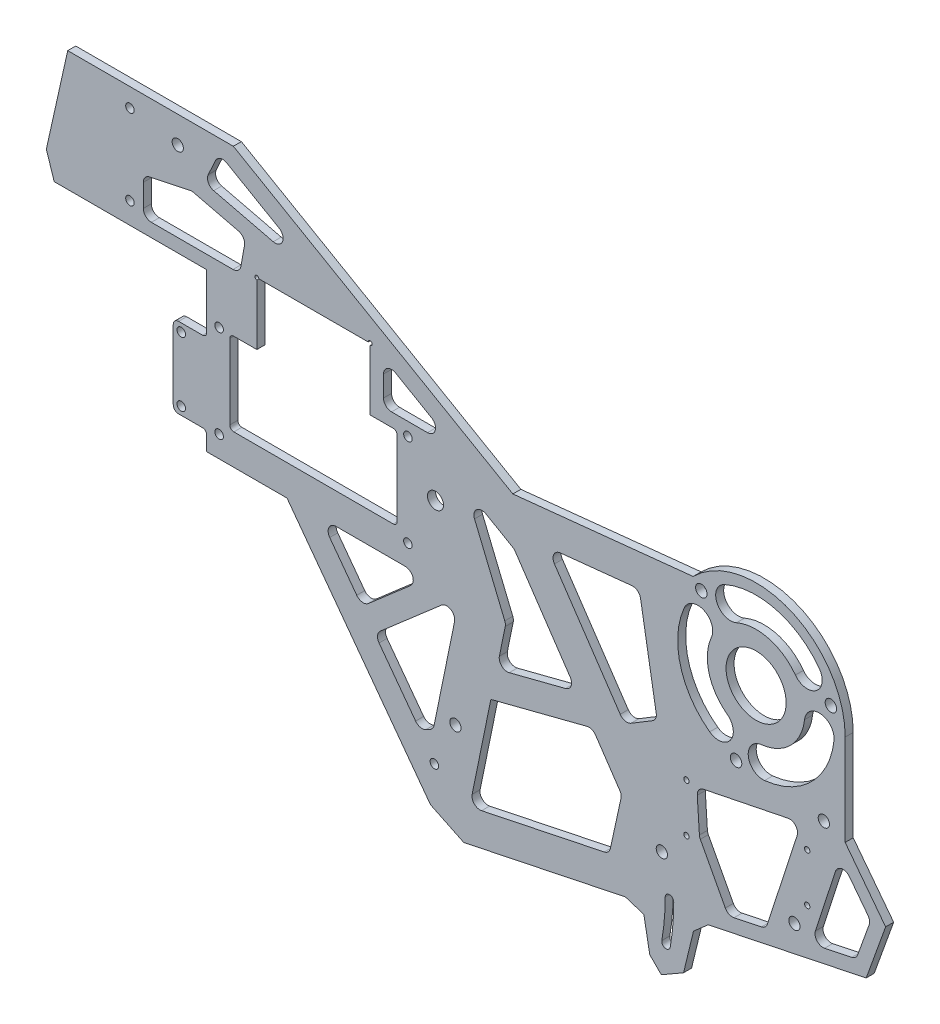
from build123d import *

# Parameters (mm, degrees)
SKETCH1_W           = 184.414327478
SKETCH1_H           = 83.61431582
BOSS_EXTRUDE1_DEPTH = 3
SKETCH2_R           = 3
CUT_EXTRUDE1_DEPTH  = 70
SKETCH3_R           = 11.25
CUT_EXTRUDE2_DEPTH  = 3
SKETCH4_R           = 1.6
BOSS_EXTRUDE2_DEPTH = 3
CUT_EXTRUDE3_DEPTH  = 10
SKETCH6_R           = 1.6
CUT_EXTRUDE4_DEPTH  = 3
FILLET1_R           = 1.5
SKETCH8_R           = 1.6
CUT_EXTRUDE6_DEPTH  = 12
SKETCH9_R           = 2.15
CUT_EXTRUDE7_DEPTH  = 12
BOSS_EXTRUDE3_DEPTH = 3
SKETCH12_R          = 1.6
CUT_EXTRUDE8_DEPTH  = 10
SKETCH13_R          = 1
CUT_EXTRUDE9_DEPTH  = 10
CUT_EXTRUDE10_START = -10
CUT_EXTRUDE10_DEPTH = 10
FILLET2_R           = 3
BOSS_EXTRUDE4_DEPTH = 3
SKETCH18_R          = 2.1
CUT_EXTRUDE11_DEPTH = 3
CUT_EXTRUDE12_DEPTH = 3
CUT_EXTRUDE13_DEPTH = 10
BOSS_EXTRUDE5_DEPTH = 3
CUT_EXTRUDE14_DEPTH = 10
BOSS_EXTRUDE7_DEPTH = 3
SKETCH24_W          = 17.029361635
SKETCH24_H          = 15.775010261
CUT_EXTRUDE15_DEPTH = 3
CUT_EXTRUDE16_DEPTH = 3
CUT_EXTRUDE17_DEPTH = 3
BOSS_EXTRUDE8_DEPTH = 3


with BuildPart() as part:
    # Sketch1 → Boss-Extrude1 (new body)
    with BuildSketch(Plane.XY):
        with Locations((112.494062572, 5.79284209)):
            Rectangle(SKETCH1_W, SKETCH1_H)
    extrude(amount=BOSS_EXTRUDE1_DEPTH)

    # Sketch2 → Cut-Extrude1 (cut)
    with BuildSketch(Plane(origin=(0, 0, 0), x_dir=(-1, 0, 0), z_dir=(0, 0, -1))):
        with Locations((-24.116880081, 24)):
            Circle(SKETCH2_R)
    extrude(amount=-CUT_EXTRUDE1_DEPTH, mode=Mode.SUBTRACT)

    # Sketch3 → Cut-Extrude2 (cut)
    with BuildSketch(Plane.XY.offset(3)):
        with Locations((144.116880081, 24)):
            Circle(SKETCH3_R)
    extrude(amount=-CUT_EXTRUDE2_DEPTH, mode=Mode.SUBTRACT)

    # Sketch4 → Boss-Extrude2 (add)
    with BuildSketch(Plane.XY.offset(3)):
        with BuildLine():
            Line((-61.543119919, 56), (-61.543119919, 34))
            Line((-61.543119919, 34), (-72.043119919, 34))
            ThreePointArc((-72.043119919, 34), (-73.457333481, 33.414213562), (-74.043119919, 32))
            Line((-74.043119919, 32), (-74.043119919, 6))
            ThreePointArc((-74.043119919, 6), (-73.457333481, 4.585786438), (-72.043119919, 4))
            Line((-72.043119919, 4), (-61.543119919, 4))
            Line((-61.543119919, 4), (-61.543119919, -26))
            Line((-61.543119919, -26), (34.701226311, -81.566699204))
            Line((34.701226311, -81.566699204), (204.701226311, -81.566699204))
            Line((204.701226311, -81.566699204), (204.701226311, -36.01431582))
            Line((204.701226311, -36.01431582), (20.286898833, -36.01431582))
            Line((20.286898833, -36.01431582), (20.286898833, 47.6))
            Line((20.286898833, 47.6), (40.948393205, 47.6))
            Line((40.948393205, 47.6), (-51.543119919, 101))
            Line((-51.543119919, 101), (-121.543119919, 101))
            Line((-121.543119919, 101), (-121.543119919, 56))
            Line((-121.543119919, 56), (-61.543119919, 56))
        make_face()
        with Locations((-71.043119919, 31)):
            Circle(SKETCH4_R, mode=Mode.SUBTRACT)
        with Locations((-71.043119919, 7)):
            Circle(SKETCH4_R, mode=Mode.SUBTRACT)
    extrude(amount=-BOSS_EXTRUDE2_DEPTH)

    # Sketch5 → Cut-Extrude3 (cut)
    with BuildSketch(Plane.XY.offset(3)):
        with BuildLine():
            Line((8.286898833, 8.5), (-51.373138671, 8.5))
            ThreePointArc((-51.373138671, 8.5), (-52.433798843, 8.939339828), (-52.873138671, 10))
            Line((-52.873138671, 10), (-52.873138671, 38))
            ThreePointArc((-52.873138671, 38), (-52.433798843, 39.060660172), (-51.373138671, 39.5))
            Line((-51.373138671, 39.5), (-42.743119919, 39.5))
            Line((-42.743119919, 39.5), (-42.743119919, 62.05))
            ThreePointArc((-42.743119919, 62.05), (-43.273450005, 63.330330086), (-41.993119919, 62.8))
            Line((-41.993119919, 62.8), (-1.093119919, 62.8))
            ThreePointArc((-1.093119919, 62.8), (0.187210167, 63.330330086), (-0.343119919, 62.05))
            Line((-0.343119919, 62.05), (-0.343119919, 39.5))
            Line((-0.343119919, 39.5), (8.286898833, 39.5))
            ThreePointArc((8.286898833, 39.5), (9.347559005, 39.060660172), (9.786898833, 38))
            Line((9.786898833, 38), (9.786898833, 10))
            ThreePointArc((9.786898833, 10), (9.347559005, 8.939339828), (8.286898833, 8.5))
        make_face()
    extrude(amount=-CUT_EXTRUDE3_DEPTH, mode=Mode.SUBTRACT)

    # Sketch6 → Cut-Extrude4 (cut)
    with BuildSketch(Plane.XY.offset(3)):
        with Locations((13.786898833, 5)):
            Circle(SKETCH6_R)
        with Locations((13.786898833, 39.6)):
            Circle(SKETCH6_R)
        with Locations((-56.873138671, 5)):
            Circle(SKETCH6_R)
        with Locations((-56.873138671, 39.6)):
            Circle(SKETCH6_R)
    extrude(amount=-CUT_EXTRUDE4_DEPTH, mode=Mode.SUBTRACT)

    # Fillet1
    fillet1_edges = [part.edges().sort_by_distance(p)[0] for p in [
        (-61.543119919, 4, 1.5),
        (-61.543119919, 34, 1.5),
    ]]
    fillet(fillet1_edges, radius=FILLET1_R)

    # Sketch8 → Cut-Extrude6 (cut)
    with BuildSketch(Plane.XY.offset(3)):
        with Locations((-90.243119919, 94)):
            Circle(SKETCH8_R)
        with Locations((-90.243119919, 64)):
            Circle(SKETCH8_R)
    extrude(amount=-CUT_EXTRUDE6_DEPTH, mode=Mode.SUBTRACT)

    # Sketch9 → Cut-Extrude7 (cut)
    with BuildSketch(Plane(origin=(0, 0, 0), x_dir=(-1, 0, 0), z_dir=(0, 0, -1))):
        with Locations((-172.128729044, 31.505752308)):
            Circle(SKETCH9_R)
        with Locations((-123.610783427, 44.506096654)):
            Circle(SKETCH9_R)
        with Locations((-136.611127773, -4.011848962)):
            Circle(SKETCH9_R)
    extrude(amount=-CUT_EXTRUDE7_DEPTH, mode=Mode.SUBTRACT)

    # Sketch10 → Boss-Extrude3 (add)
    with BuildSketch(Plane(origin=(0, 0, 0), x_dir=(-1, 0, 0), z_dir=(0, 0, -1))):
        with BuildLine():
            Line((-167.680888654, 47.6), (-120.552871509, 47.6))
            ThreePointArc((-120.552871509, 47.6), (-144.116880081, 57.35), (-167.680888654, 47.6))
        make_face()
    extrude(amount=-BOSS_EXTRUDE3_DEPTH)

    # Sketch12 → Cut-Extrude8 (cut)
    with BuildSketch(Plane.XY.offset(3)):
        with Locations((23.701226311, -61.566699204)):
            Circle(SKETCH12_R)
        with BuildLine():
            ThreePointArc((110.101226311, -61.566699204), (109.784541603, -68.957425033), (108.836808989, -76.293971931))
            ThreePointArc((108.836808989, -76.293971931), (110.140666581, -78.143284068), (111.989978718, -76.839426476))
            ThreePointArc((111.989978718, -76.839426476), (112.97281254, -69.231155619), (113.301226311, -61.566699204))
            ThreePointArc((113.301226311, -61.566699204), (111.701226311, -59.966699204), (110.101226311, -61.566699204))
        make_face()
    extrude(amount=-CUT_EXTRUDE8_DEPTH, mode=Mode.SUBTRACT)

    # Sketch13 → Cut-Extrude9 (cut)
    with BuildSketch(Plane(origin=(0, 0, 0), x_dir=(-1, 0, 0), z_dir=(0, 0, -1))):
        with Locations((-163.256880081, -19.666699204)):
            Circle(SKETCH13_R)
        with Locations((-163.256880081, -37.666699204)):
            Circle(SKETCH13_R)
        with Locations((-118.056880081, -19.666699204)):
            Circle(SKETCH13_R)
        with Locations((-118.056880081, -37.666699204)):
            Circle(SKETCH13_R)
    extrude(amount=-CUT_EXTRUDE9_DEPTH, mode=Mode.SUBTRACT)

    # Sketch16 → Cut-Extrude10 (cut)
    with BuildSketch(Plane.XY.offset(3).offset(CUT_EXTRUDE10_START)):
        with BuildLine():
            Line((185.325635428, -50.178485254), (192.610066917, -29.966985111))
            Line((192.610066917, -29.966985111), (177.466624901, -10.155091534))
            Line((177.466624901, -10.155091534), (177.46688008, 23.999750834))
            ThreePointArc((177.46688008, 23.999750834), (174.923438362, 36.774132726), (167.680888654, 47.6))
            Line((167.680888654, 47.6), (204.701226311, 47.6))
            Line((204.701226311, 47.6), (204.701226311, -81.566699204))
            Line((204.701226311, -81.566699204), (109.015798372, -101.506327194))
            Line((109.015798372, -101.506327194), (-44.901184683, -81.566699204))
            Line((-44.901184683, -81.566699204), (-83.479855962, -7.179423821))
            Line((-83.479855962, -7.179423821), (-61.543119919, 0.5))
            Line((-61.543119919, 0.5), (-10.377615905, -59.783091395))
            Line((-10.377615905, -59.783091395), (34.701226311, -81.566699204))
            Line((34.701226311, -81.566699204), (95.172760947, -68.965199366))
            Line((95.172760947, -68.965199366), (102.113936995, -71.163480303))
            Line((102.113936995, -71.163480303), (104.337885566, -83.247775468))
            Line((104.337885566, -83.247775468), (107.080942415, -86.649887581))
            Line((107.080942415, -86.649887581), (116.929327033, -82.818994447))
            Line((116.929327033, -82.818994447), (120.691367686, -67.292179678))
            Line((120.691367686, -67.292179678), (126.176730317, -62.504365896))
            Line((126.176730317, -62.504365896), (185.325635428, -50.178485254))
        make_face()
        Polygon((181.569463907, -45.853814209), (186.98169326, -30.836956064), (175.587529072, -15.930175425), (164.707665864, -49.367598778), align=None)
        Polygon((147.786240628, -52.893808898), (133.646418373, -55.840368282), (122.940030102, -35.687729471), (121.928442119, -19.944750575), (161.094031546, -11.994559496), align=None)
        Polygon((89.166717868, -57.958999698), (93.826808725, -36.561374232), (82.859070044, -20.334560064), (44.843332342, -30.101550826), (36.922170316, -68.846099909), align=None)
        Polygon((76.913076188, -11.537437872), (47.071209453, -19.204400407), (50.404084791, -2.902404349), (35.32234623, 33.6), (46.404584615, 33.6), align=None)
        Polygon((94.86090031, -13.090702215), (107.087345897, -5.711274922), (100.36312134, 33.6), (63.30255402, 33.6), align=None)
        Polygon((12.323472505, -57.425373854), (22.136022596, -41.32020616), (30.031020571, -2.703632538), (-25.068997653, -30.11082242), (-11.765789474, -45.784634883), align=None)
        Polygon((-31.734510056, -22.257529442), (1.788643564, -5.582844635), (-2.128574469, 0.5), (-41.543119919, 0.5), (-41.543119919, -10.701045514), align=None)
        Polygon((32.317750709, 44.5), (4.656880081, 44.5), (4.656880081, 60.470011103), align=None)
        Polygon((-16.348136015, 72.5972628), (-56.880404544, 95.998578946), (-62.456657233, 83.781845933), align=None)
        Polygon((-49.161692729, 61), (-46.86151067, 73.82491911), (-67.080486661, 78.72945328), (-85.243119919, 74.895250525), (-85.243119919, 61), align=None)
    extrude(amount=CUT_EXTRUDE10_DEPTH, mode=Mode.SUBTRACT)

    # Fillet2
    fillet2_edges = [part.edges().sort_by_distance(p)[0] for p in [
        (-16.348136015, 72.5972628, 1.5),
        (-62.456657233, 83.781845933, 1.5),
        (-56.880404544, 95.998578946, 1.5),
        (-49.161692729, 61, 1.5),
        (-85.243119919, 61, 1.5),
        (-85.243119919, 74.895250525, 1.5),
        (-67.080486661, 78.72945328, 1.5),
        (-46.86151067, 73.82491911, 1.5),
        (181.569463907, -45.853814209, 1.5),
        (164.707665864, -49.367598778, 1.5),
        (175.587529072, -15.930175425, 1.5),
        (186.98169326, -30.836956064, 1.5),
        (161.094031546, -11.994559496, 1.5),
        (147.786240628, -52.893808898, 1.5),
        (133.646418373, -55.840368282, 1.5),
        (122.940030102, -35.687729471, 1.5),
        (121.928442119, -19.944750575, 1.5),
        (89.166717868, -57.958999698, 1.5),
        (36.922170316, -68.846099909, 1.5),
        (82.859070044, -20.334560064, 1.5),
        (93.826808725, -36.561374232, 1.5),
        (46.404584615, 33.6, 1.5),
        (76.913076188, -11.537437872, 1.5),
        (47.071209453, -19.204400407, 1.5),
        (50.404084791, -2.902404349, 1.5),
        (35.32234623, 33.6, 1.5),
        (4.656880081, 60.470011103, 1.5),
        (32.317750709, 44.5, 1.5),
        (4.656880081, 44.5, 1.5),
        (-31.734510056, -22.257529442, 1.5),
        (-41.543119919, -10.701045514, 1.5),
        (-41.543119919, 0.5, 1.5),
        (-2.128574469, 0.5, 1.5),
        (1.788643564, -5.582844635, 1.5),
        (12.323472505, -57.425373854, 1.5),
        (-11.765789474, -45.784634883, 1.5),
        (-25.068997653, -30.11082242, 1.5),
        (30.031020571, -2.703632538, 1.5),
        (22.136022596, -41.32020616, 1.5),
        (94.86090031, -13.090702215, 1.5),
        (63.30255402, 33.6, 1.5),
        (100.36312134, 33.6, 1.5),
        (107.087345897, -5.711274922, 1.5),
    ]]
    fillet(fillet2_edges, radius=FILLET2_R)

    # Sketch17 → Boss-Extrude4 (add)
    with BuildSketch(Plane.XY.offset(3)):
        Polygon((34.701226311, -81.566699204), (-10.377615905, -59.783091395), (-17.438763163, -51.463662245), align=None)
    extrude(amount=-BOSS_EXTRUDE4_DEPTH)

    # Sketch18 → Cut-Extrude11 (cut)
    with BuildSketch(Plane.XY.offset(3)):
        with Locations((31.583807527, -45.033004622)):
            Circle(SKETCH18_R)
        with Locations((-72.352922935, 91)):
            Circle(SKETCH18_R)
        with Locations((108.840100712, -47.513424086)):
            Circle(SKETCH18_R)
        with Locations((158.466357649, -45.925703464)):
            Circle(SKETCH18_R)
        with Locations((169.466646726, -7.233826143)):
            Circle(SKETCH18_R)
    extrude(amount=-CUT_EXTRUDE11_DEPTH, mode=Mode.SUBTRACT)

    # Sketch19 → Cut-Extrude12 (cut)
    with BuildSketch(Plane.XY.offset(3)):
        with BuildLine():
            ThreePointArc((158.83225844, 34.794449489), (166.590041703, 33.602057421), (167.78243377, 41.359840685))
            ThreePointArc((167.78243377, 41.359840685), (151.713219055, 52.349923002), (132.301829734, 50.866839883))
            ThreePointArc((132.301829734, 50.866839883), (129.455579924, 43.552206466), (136.770213341, 40.705956656))
            ThreePointArc((136.770213341, 40.705956656), (148.840327654, 41.62814633), (158.83225844, 34.794449489))
        make_face()
        with BuildLine():
            ThreePointArc((127.410923425, 31.346666741), (124.564673615, 38.661300157), (117.250040198, 35.815050347))
            ThreePointArc((117.250040198, 35.815050347), (115.76695708, 16.403661026), (126.757039397, 0.334446311))
            ThreePointArc((126.757039397, 0.334446311), (134.51482266, 1.526838378), (133.322430592, 9.284621641))
            ThreePointArc((133.322430592, 9.284621641), (126.488733751, 19.276552427), (127.410923425, 31.346666741))
        make_face()
        with BuildLine():
            ThreePointArc((147.318166275, -5.174891032), (164.870464109, 3.246415972), (173.291771113, 20.798713806))
            ThreePointArc((173.291771113, 20.798713806), (168.38023766, 26.920955155), (162.25799631, 22.009421702))
            ThreePointArc((162.25799631, 22.009421702), (157.021578838, 11.095301243), (146.107458379, 5.858883771))
            ThreePointArc((146.107458379, 5.858883771), (141.195924926, -0.263357578), (147.318166275, -5.174891032))
        make_face()
    extrude(amount=-CUT_EXTRUDE12_DEPTH, mode=Mode.SUBTRACT)

    # Sketch20 → Cut-Extrude13 (cut)
    with BuildSketch(Plane.XY.offset(3)):
        Polygon((-113.543119919, 101), (-121.543119919, 101), (-121.543119919, 65.062774312), align=None)
        Polygon((-118.598446043, 56), (-121.543119919, 65.062774312), (-121.543119919, 56), align=None)
    extrude(amount=-CUT_EXTRUDE13_DEPTH, mode=Mode.SUBTRACT)

    # Sketch21 → Boss-Extrude5 (add)
    with BuildSketch(Plane.XY.offset(3)):
        Polygon((117.232749576, -81.566699204), (116.96645292, -82.665767299), (108.657506969, -87.46293948), (104.314325759, -83.11975827), (104.028506566, -81.566699204), align=None)
    extrude(amount=-BOSS_EXTRUDE5_DEPTH)

    # Sketch22 → Cut-Extrude14 (cut)
    with BuildSketch(Plane.XY.offset(3)):
        Polygon((22.245960614, -75.547897261), (-29.744865769, -5.321611699), (-61.543119919, -5.321611699), (-61.543119919, 0.5), (-101.253001454, -52.956248508), align=None)
    extrude(amount=-CUT_EXTRUDE14_DEPTH, mode=Mode.SUBTRACT)

    # Sketch23 → Boss-Extrude7 (add)
    with BuildSketch(Plane.XY.offset(3)):
        Polygon((22.245960614, -75.547897261), (-31.463631183, -3), (-61.543119919, -3), (-61.543119919, 0.5), (0.079563838, 0.5), (9.364923533, -1.406610369), (34.185770163, 1.811340502), (25.985988108, -38.122317169), (19.932958192, -56.258720546), align=None)
    extrude(amount=-BOSS_EXTRUDE7_DEPTH)

    # Sketch24 → Cut-Extrude15 (cut)
    with BuildSketch(Plane.XY.offset(3)):
        with Locations((-50.057800737, -10.887505131)):
            Rectangle(SKETCH24_W, SKETCH24_H)
    extrude(amount=-CUT_EXTRUDE15_DEPTH, mode=Mode.SUBTRACT)

    # Sketch25 → Cut-Extrude16 (cut)
    with BuildSketch(Plane.XY.offset(3)):
        with BuildLine():
            Line((16.675157033, -51.216894022), (2.995479824, -32.739155066))
            ThreePointArc((2.995479824, -32.739155066), (2.424525914, -30.626839071), (3.440002978, -28.688625057))
            Line((3.440002978, -28.688625057), (26.355673645, -8.796002503))
            ThreePointArc((26.355673645, -8.796002503), (29.835741353, -8.471220063), (31.261494647, -11.662392642))
            Line((31.261494647, -11.662392642), (23.59441239, -49.164168752))
            ThreePointArc((23.59441239, -49.164168752), (23.073231646, -50.338978364), (22.108261474, -51.187883282))
            Line((22.108261474, -51.187883282), (20.539350273, -52.056468682))
            ThreePointArc((20.539350273, -52.056468682), (18.449348554, -52.363449137), (16.675157033, -51.216894022))
        make_face()
        with BuildLine():
            Line((-0.982133366, -21.933620712), (14.763128686, -8.265482452))
            ThreePointArc((14.763128686, -8.265482452), (15.606887802, -4.950344665), (12.796509948, -3))
            Line((12.796509948, -3), (-13.067723904, -3))
            ThreePointArc((-13.067723904, -3), (-15.746822882, -4.650026421), (-15.478865795, -7.785047557))
            Line((-15.478865795, -7.785047557), (-5.359893995, -21.453185817))
            ThreePointArc((-5.359893995, -21.453185817), (-3.276020542, -22.650234062), (-0.982133366, -21.933620712))
        make_face()
    extrude(amount=-CUT_EXTRUDE16_DEPTH, mode=Mode.SUBTRACT)

    # Sketch26 → Cut-Extrude17 (cut)
    with BuildSketch(Plane.XY.offset(3)):
        Polygon((40.948393205, 47.6), (53.072748858, 40.6), (120.552871509, 47.6), align=None)
    extrude(amount=-CUT_EXTRUDE17_DEPTH, mode=Mode.SUBTRACT)

    # Sketch27 → Boss-Extrude8 (add)
    with BuildSketch(Plane.XY.offset(3)):
        with BuildLine():
            Line((101.250531044, 28.412010432), (100.863259918, 30.676081417))
            ThreePointArc((100.863259918, 30.676081417), (99.719401901, 32.56032239), (97.59666556, 33.154263158))
            Line((97.59666556, 33.154263158), (70.810270819, 30.375596555))
            ThreePointArc((70.810270819, 30.375596555), (68.401141551, 28.660004425), (68.634306829, 25.711649945))
            Line((68.634306829, 25.711649945), (74.246041606, 17.409065426))
            Line((74.246041606, 17.409065426), (55.517456287, 34.991473507))
            Line((55.517456287, 34.991473507), (110.102363214, 37.946841418))
            Line((110.102363214, 37.946841418), (101.250531044, 28.412010432))
        make_face()
        with BuildLine():
            Line((43.004090461, 29.09263456), (52.97851836, 23.333895928))
            ThreePointArc((52.97851836, 23.333895928), (53.523463091, 22.930859818), (53.964024103, 22.415778407))
            Line((53.964024103, 22.415778407), (60.830105813, 12.257382477))
            Line((60.830105813, 12.257382477), (47.398285526, 37.946841418))
            Line((47.398285526, 37.946841418), (28.883739191, 36.026248816))
            Line((28.883739191, 36.026248816), (40.801126272, 20.339682323))
            Line((40.801126272, 20.339682323), (38.731431053, 25.348975611))
            ThreePointArc((38.731431053, 25.348975611), (39.527057059, 28.750957898), (43.004090461, 29.09263456))
        make_face()
    extrude(amount=-BOSS_EXTRUDE8_DEPTH)


solid = part.part
